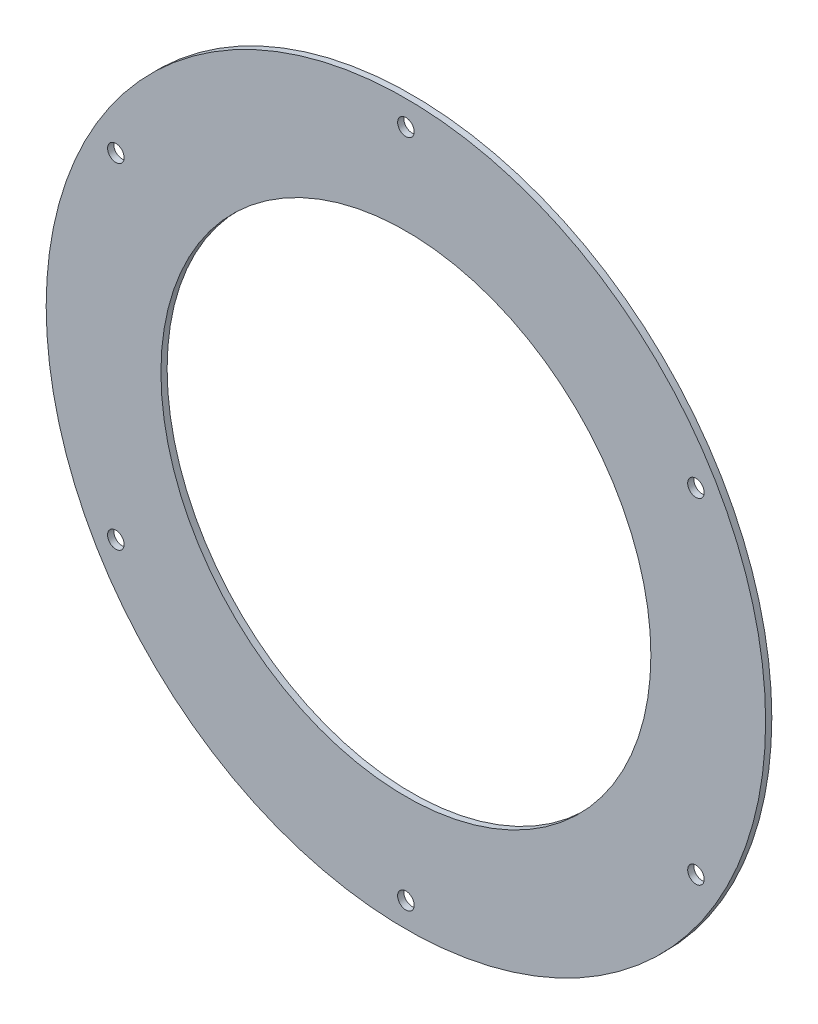
from build123d import *

# Parameters (mm, degrees)
SKETCH1_R           = 174
SKETCH1_R_2         = 4
SKETCH1_R_3         = 118.5
BOSS_EXTRUDE1_DEPTH = 3


with BuildPart() as part:
    # Sketch1 → Boss-Extrude1 (new body)
    with BuildSketch(Plane.XY):
        Circle(SKETCH1_R)
        with Locations((0, 162)):
            Circle(SKETCH1_R_2, mode=Mode.SUBTRACT)
        with Locations((140.296115413, 81)):
            Circle(SKETCH1_R_2, mode=Mode.SUBTRACT)
        with Locations((140.296115413, -81)):
            Circle(SKETCH1_R_2, mode=Mode.SUBTRACT)
        with Locations((0, -162)):
            Circle(SKETCH1_R_2, mode=Mode.SUBTRACT)
        with Locations((-140.296115413, -81)):
            Circle(SKETCH1_R_2, mode=Mode.SUBTRACT)
        with Locations((-140.296115413, 81)):
            Circle(SKETCH1_R_2, mode=Mode.SUBTRACT)
        Circle(SKETCH1_R_3, mode=Mode.SUBTRACT)
    extrude(amount=BOSS_EXTRUDE1_DEPTH)


solid = part.part
